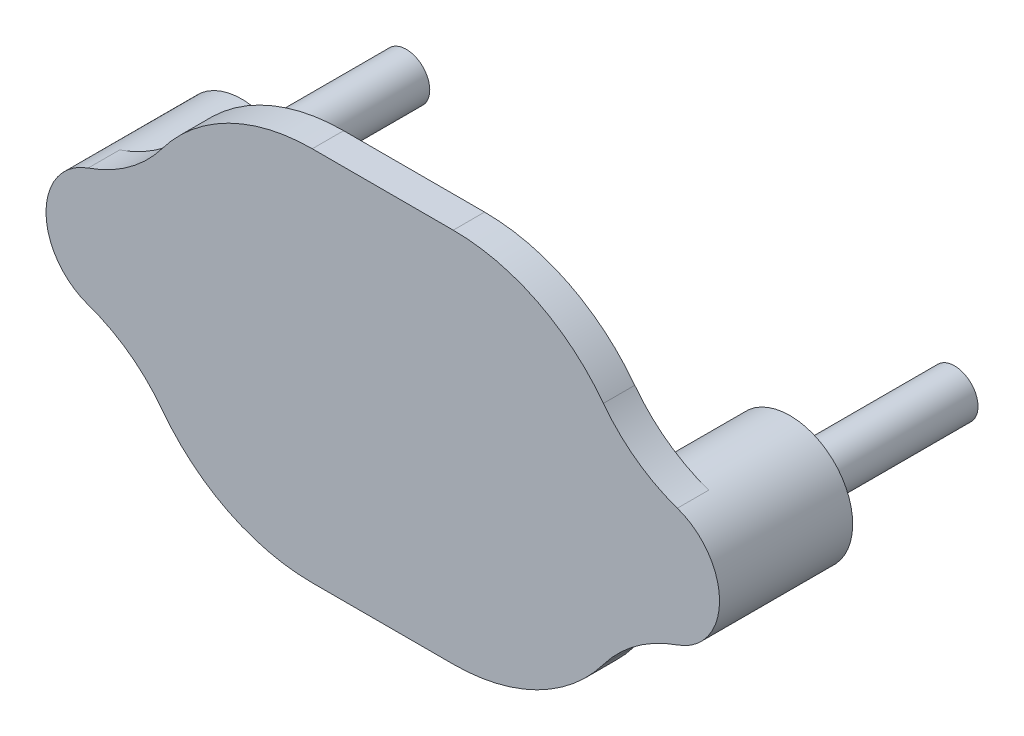
from build123d import *

# Parameters (mm, degrees)
EXTRUDE_1_DEPTH = 2
SKETCH_2_R      = 4
EXTRUDE_2_DEPTH = 6.5
SKETCH_3_R      = 1.5
EXTRUDE_3_DEPTH = 10.5


with BuildPart() as part:
    # 草图1 → 凸台-拉伸1 (new body)
    with BuildSketch(Plane.XY):
        with BuildLine():
            Line((-4.5, 12), (4.5, 12))
            ThreePointArc((4.5, 12), (9.857189903, 10.7378078), (14.087412587, 7.216752724))
            ThreePointArc((14.087412587, 7.216752724), (16.191153731, 5.146301215), (18.807692308, 3.780203808))
            ThreePointArc((18.807692308, 3.780203808), (21.5, 0), (18.807692308, -3.780203808))
            ThreePointArc((18.807692308, -3.780203808), (16.191153731, -5.146301215), (14.087412587, -7.216752724))
            ThreePointArc((14.087412587, -7.216752724), (9.857189903, -10.7378078), (4.5, -12))
            Line((4.5, -12), (-4.5, -12))
            ThreePointArc((-4.5, -12), (-9.857189903, -10.7378078), (-14.087412587, -7.216752724))
            ThreePointArc((-14.087412587, -7.216752724), (-16.191153731, -5.146301215), (-18.807692308, -3.780203808))
            ThreePointArc((-18.807692308, -3.780203808), (-21.5, 0), (-18.807692308, 3.780203808))
            ThreePointArc((-18.807692308, 3.780203808), (-16.191153731, 5.146301215), (-14.087412587, 7.216752724))
            ThreePointArc((-14.087412587, 7.216752724), (-9.857189903, 10.7378078), (-4.5, 12))
        make_face()
    extrude(amount=-EXTRUDE_1_DEPTH)

    # 草图2 → 凸台-拉伸2 (add)
    with BuildSketch(Plane(origin=(0, 0, -2), x_dir=(-1, 0, 0), z_dir=(0, 0, -1))):
        with Locations(Location((17.5, 0, 0), (0, 0, 289.082124804))):
            Circle(SKETCH_2_R)
        with Locations(Location((-17.5, 0, 0), (0, 0, 250.917875196))):
            Circle(SKETCH_2_R)
    extrude(amount=EXTRUDE_2_DEPTH)

    # 草图3 → 凸台-拉伸3 (add)
    with BuildSketch(Plane(origin=(0, 0, -8.5), x_dir=(-1, 0, 0), z_dir=(0, 0, -1))):
        with Locations(Location((17.5, 0, 0), (0, 0, 180))):
            Circle(SKETCH_3_R)
        with Locations(Location((-17.5, 0, 0), (0, 0, 180))):
            Circle(SKETCH_3_R)
    extrude(amount=EXTRUDE_3_DEPTH)


solid = part.part
